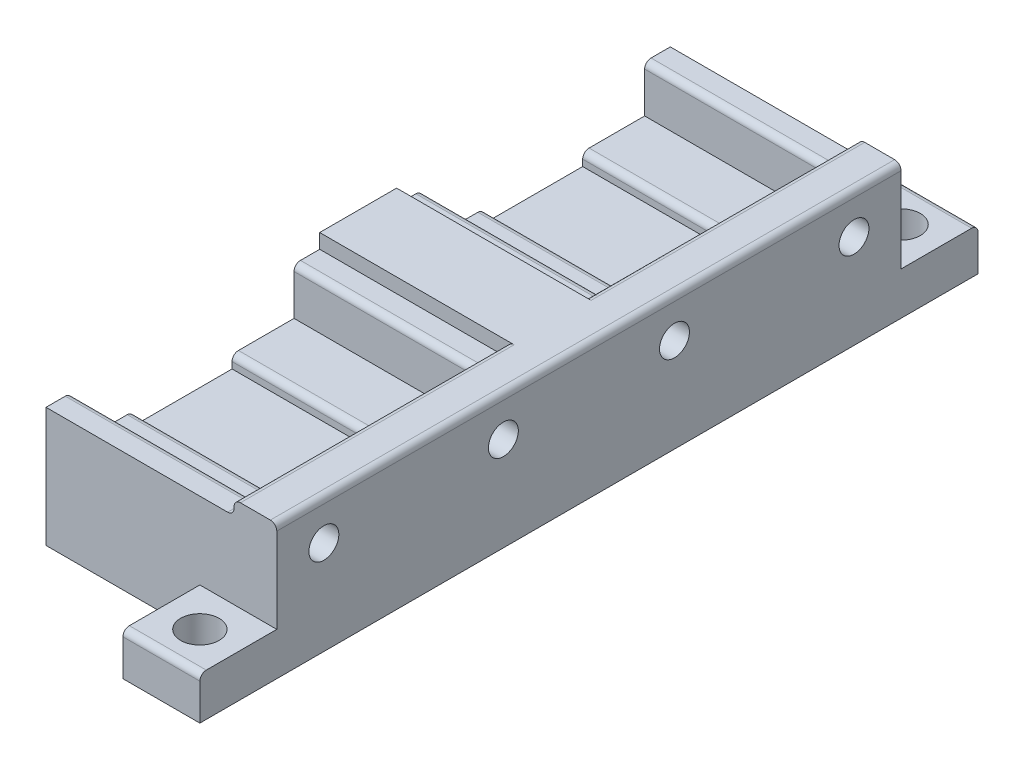
from build123d import *

# Parameters (mm, degrees)
BOSS_EXTRUDE1_DEPTH = 11
SKETCH3_W           = 22
SKETCH3_H           = 3
BOSS_EXTRUDE2_DEPTH = 14
BOSS_EXTRUDE3_DEPTH = 5
SKETCH5_R           = 1.75
CUT_EXTRUDE1_DEPTH  = 36.096650541
SKETCH6_W           = 9
SKETCH6_H           = 9
BOSS_EXTRUDE4_DEPTH = 5
SKETCH10_R          = 2.25
CUT_EXTRUDE2_DEPTH  = 34.584744739
SKETCH8_W           = 27
SKETCH8_H           = 15.7
BOSS_EXTRUDE5_DEPTH = 4.5
FILLET1_R           = 0.75


with BuildPart() as part:
    # Sketch1 → Boss-Extrude1 (new, symmetric)
    with BuildSketch(Plane(origin=(0, 0, 0), x_dir=(0, 0, -1), z_dir=(1, 0, 0))):
        Polygon((-13.0089, 0), (13.0089, 0), (13.0089, 8.5), (5.7589, 8.5), (5.7589, 7), (-5.7589, 7), (-5.7589, 8.5), (-13.0089, 8.5), align=None)
    extrude(amount=BOSS_EXTRUDE1_DEPTH, both=True)

    # Sketch3 → Boss-Extrude2 (add)
    with BuildSketch(Plane.XZ):
        with Locations((0, -14.5089)):
            Rectangle(SKETCH3_W, SKETCH3_H)
        with Locations((0, 14.5089)):
            Rectangle(SKETCH3_W, SKETCH3_H)
    extrude(amount=-BOSS_EXTRUDE2_DEPTH)

    # Sketch4 → Boss-Extrude3 (add)
    with BuildSketch(Plane(origin=(11, 0, 0), x_dir=(0, 0, -1), z_dir=(1, 0, 0))):
        Polygon((-8.8, 15.7), (-16.0089, 15.7), (-16.0089, 0), (16.0089, 0), (16.0089, 15.7), align=None)
    extrude(amount=BOSS_EXTRUDE3_DEPTH)

    # Sketch5 → Cut-Extrude1 (cut, through all)
    with BuildSketch(Plane(origin=(16, 0, 0), x_dir=(0, 0, -1), z_dir=(1, 0, 0))):
        with Locations((-10.5, 11)):
            Circle(SKETCH5_R)
        with Locations((10.5, 11)):
            Circle(SKETCH5_R)
    extrude(amount=-CUT_EXTRUDE1_DEPTH, mode=Mode.SUBTRACT)

    # Sketch6 → Boss-Extrude4 (add)
    with BuildSketch(Plane.XZ):
        with Locations((11.5, 20.5089)):
            Rectangle(SKETCH6_W, SKETCH6_H)
    extrude(amount=-BOSS_EXTRUDE4_DEPTH)

    # Sketch10 → Cut-Extrude2 (cut, through all)
    with BuildSketch(Plane.XZ):
        with Locations(Location((11.5, 20.5089, 0), (0, 0, 270))):
            Circle(SKETCH10_R)
    extrude(amount=-CUT_EXTRUDE2_DEPTH, mode=Mode.SUBTRACT)

    # Sketch8 → Boss-Extrude5 (add)
    with BuildSketch(Plane(origin=(0, 0, -16.0089), x_dir=(-1, 0, 0), z_dir=(0, 0, -1))):
        with Locations((-2.5, 7.85)):
            Rectangle(SKETCH8_W, SKETCH8_H)
    extrude(amount=BOSS_EXTRUDE5_DEPTH)

    # Fillet1
    fillet1_edges = [part.edges().sort_by_distance(p)[0] for p in [
        (0, 8.5, 5.7589),
        (0, 8.5, -5.7589),
        (0, 14, -13.0089),
        (11, 14, -14.5089),
        (11, 11.25, -13.0089),
        (11, 14, 14.5089),
        (11, 11.25, 13.0089),
        (0, 14, 13.0089),
        (11, 15.7, 0),
        (16, 15.7, -2.25),
        (11.5, 5, 25.0089),
    ]]
    fillet(fillet1_edges, radius=FILLET1_R)

    # Mirror6: part across plane


with BuildPart() as part_1:
    add(part.part)
    add(part.part.mirror(Plane(origin=(0, 0, -20.5089), x_dir=(1, 0, 0), z_dir=(0, 0, -1))))


solid = part_1.part
